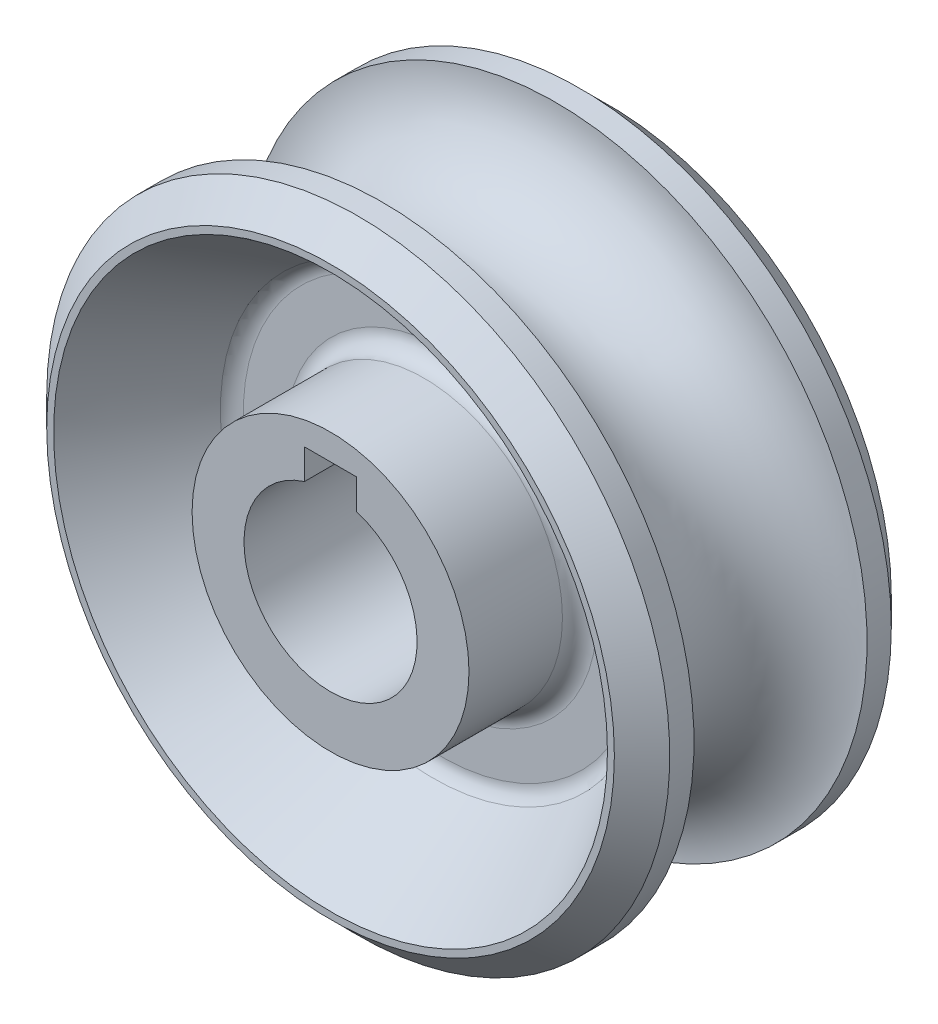
from build123d import *

# Parameters (mm, degrees)
SKETCH1_R         = 28.575
SKETCH1_R_2       = 7.9375
BASE_DEPTH        = 12.7
SKETCH2_R         = 7.9375
CHAMFER1_SIZE     = 2.54
FILLET1_R         = 1.5875
KEYWAY_DEPTH      = 43.359783404
KEYWAY_DEPTH_BACK = 43.359783404
SKETCH4_W         = 4.7752
SKETCH4_H         = 10.3251


with BuildPart() as part:
    # Sketch1 → Base (new, symmetric)
    with BuildSketch(Plane.XY):
        with Locations(Location((0, 0, 0), (0, 0, 180))):
            Circle(SKETCH1_R)
        with Locations(Location((0, 0, 0), (0, 0, 180))):
            Circle(SKETCH1_R_2, mode=Mode.SUBTRACT)
    extrude(amount=BASE_DEPTH, both=True)

    # Sketch2 → Groove (revolve, cut)
    with BuildSketch(Plane(origin=(0, 0, 0), x_dir=(0, 0, -1), z_dir=(1, 0, 0)), mode=Mode.PRIVATE) as groove_sk:
        with Locations((0, 28.575)):
            Circle(SKETCH2_R)
    revolve(groove_sk.sketch.rotate(Axis((0, 0, 0), (0, 0, -1)), 270), axis=Axis((0, 0, 0), (0, 0, -1)), mode=Mode.SUBTRACT)

    # Sketch3 → Cut-Revolve2 (revolve, cut)
    with BuildSketch(Plane(origin=(0, 0, 0), x_dir=(0, 0, -1), z_dir=(1, 0, 0)), mode=Mode.PRIVATE) as cut_revolve2_sk:
        Polygon((12.7, 25.4), (12.7, 12.7), (2.54, 12.7), (2.54, 19.05), align=None)
        Polygon((-2.54, 12.7), (-2.54, 19.05), (-12.7, 25.4), (-12.7, 12.7), align=None)
    revolve(cut_revolve2_sk.sketch.rotate(Axis((0, 0, 0), (0, 0, -1)), 90), axis=Axis((0, 0, 0), (0, 0, -1)), mode=Mode.SUBTRACT)

    # Chamfer1
    chamfer1_edges = [part.edges().sort_by_distance(p)[0] for p in [
        (28.575, 0, -12.7),
        (28.575, 0, 12.7),
    ]]
    chamfer(chamfer1_edges, length=CHAMFER1_SIZE)

    # Fillet1
    fillet1_edges = [part.edges().sort_by_distance(p)[0] for p in [
        (-12.7, 0, -2.54),
        (-19.05, 0, -2.54),
        (-12.7, 0, 2.54),
        (-19.05, 0, 2.54),
    ]]
    fillet(fillet1_edges, radius=FILLET1_R)

    # Sketch4 → Keyway (cut, two sides: drawn at the far end of the back side and taken through both)
    with BuildSketch(Plane.XY.offset(-KEYWAY_DEPTH_BACK)):
        with Locations((0, 5.16255)):
            Rectangle(SKETCH4_W, SKETCH4_H)
    extrude(amount=KEYWAY_DEPTH + KEYWAY_DEPTH_BACK, mode=Mode.SUBTRACT)


solid = part.part
